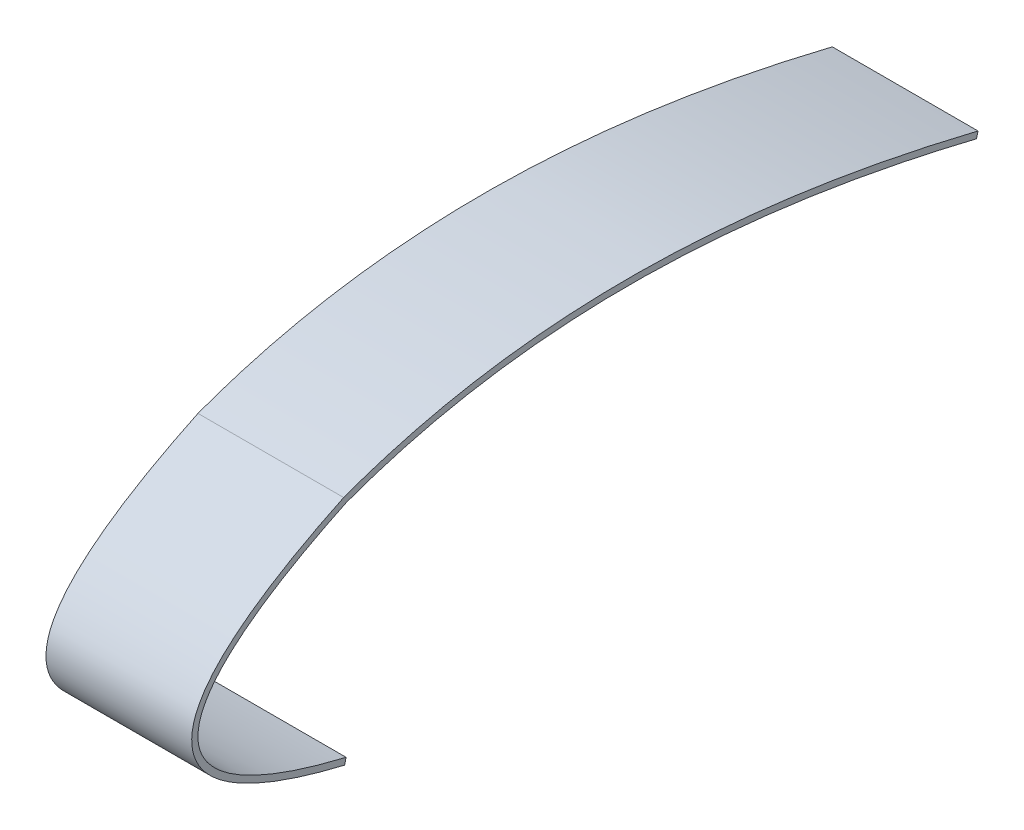
from build123d import *

# Parameters (mm, degrees)
BOSS_EXTRUDE1_DEPTH      = 350
BOSS_EXTRUDE1_DEPTH_BACK = 350


with BuildPart() as part:
    # Sketch2 → Boss-Extrude1 (new, two sides: drawn at the far end of the back side and taken through both)
    with BuildSketch(Plane(origin=(0, 0, 0), x_dir=(0, 0, -1), z_dir=(1, 0, 0)).offset(-BOSS_EXTRUDE1_DEPTH_BACK)):
        with BuildLine():
            Line((628.154342243, 1334.840970334), (635.276466748, 1363.983299386))
            add(Edge.make_bspline(
                [(635.276466748, 1363.983299386), (619.950844608, 1367.728744329), (589.310787735, 1375.144720028), (543.132871998, 1386.098493225), (496.811356933, 1396.857046899), (434.840693875, 1410.936503832), (357.011004214, 1428.015122272), (263.069150027, 1447.61141599), (168.625469332, 1466.243611988), (42.089030623, 1489.713351), (-117.119449153, 1516.311047234), (-309.483277706, 1543.317508561), (-567.257307298, 1572.073706113), (-891.024329092, 1593.097723414), (-1214.541523428, 1590.686861253), (-1471.807713301, 1572.562998322), (-1663.631190085, 1550.337124801), (-1853.974042759, 1518.942425185), (-2011.061096311, 1484.692669353), (-2135.631031426, 1452.17247831), (-2228.462601629, 1425.155446722), (-2305.289070598, 1400.396126606), (-2358.764539347, 1381.857676398), (-2385.42781594, 1372.281960642), (-2398.735147271, 1367.418607889), (-2406.341015013, 1364.615364779), (-2410.128187847, 1363.210469149), (-2412.023142039, 1362.506807039)],
                knots=[0, 0, 0, 0, 0.015631669, 0.031263337, 0.046895006, 0.062526674, 0.093790011, 0.125053348, 0.156316685, 0.187580023, 0.250106697, 0.312633371, 0.375160045, 0.500213393, 0.625266742, 0.687793416, 0.75032009, 0.812846764, 0.875373438, 0.906636776, 0.937900113, 0.96916345, 0.984795118, 0.992610953, 0.99651887, 0.998472828, 1.000426787, 1.000426787, 1.000426787, 1.000426787], degree=3))
            add(Edge.make_bspline(
                [(-2412.023142039, 1362.506807039), (-2413.547685005, 1361.783173298), (-2416.58052508, 1360.343120157), (-2422.770806958, 1357.394000429), (-2430.629476442, 1353.633622561), (-2440.279058854, 1348.987215064), (-2453.413610098, 1342.621685814), (-2470.319178756, 1334.346662012), (-2491.314943645, 1323.921419166), (-2512.951472876, 1313.013508143), (-2542.562818049, 1297.843068546), (-2580.835600509, 1277.736735779), (-2628.22946562, 1251.879622044), (-2676.544278137, 1224.390892005), (-2725.235979299, 1195.366380163), (-2789.937945212, 1154.742623046), (-2869.049993669, 1100.580279136), (-2956.862814821, 1030.817481431), (-3033.277910981, 956.760832624), (-3083.870485985, 891.587905629), (-3114.084609446, 837.188737736), (-3130.875847474, 795.192839564), (-3140.943680785, 752.025644532), (-3143.330027924, 707.941066275), (-3137.164624584, 663.534332821), (-3121.919596231, 619.601279239), (-3097.431626157, 576.773990458), (-3063.636002015, 535.312995393), (-3020.332850573, 495.202891062), (-2967.143972324, 456.332447081), (-2903.568412701, 418.602076564), (-2841.463794619, 388.065023687), (-2786.011348531, 364.174359874), (-2741.463495698, 346.528645614), (-2693.883096863, 329.159220608), (-2643.196256588, 312.071812213), (-2598.307184016, 298.073115592), (-2560.769262043, 287.022666073), (-2531.793385969, 278.810184481), (-2501.98589314, 270.674171138), (-2476.445974381, 263.958923859), (-2455.588765426, 258.626064752), (-2439.733465963, 254.646575467), (-2426.3381175, 251.346143993), (-2415.522221427, 248.717882491), (-2410.06311188, 247.4035123), (-2407.33892625, 246.750628497)],
                knots=[-0.001024345, -0.001024345, -0.001024345, -0.001024345, 0.002885906, 0.006796157, 0.01461666, 0.022437163, 0.030257665, 0.045898671, 0.061539676, 0.077180681, 0.092821687, 0.124103698, 0.155385708, 0.186667719, 0.21794973, 0.249231741, 0.311795762, 0.374359784, 0.436923806, 0.499487827, 0.530769838, 0.562051849, 0.59333386, 0.62461587, 0.655897881, 0.687179892, 0.718461903, 0.749743914, 0.781025924, 0.812307935, 0.843589946, 0.874871957, 0.890512962, 0.906153968, 0.921794973, 0.937435978, 0.953076984, 0.960897487, 0.968717989, 0.976538492, 0.984358995, 0.988269246, 0.992179497, 0.996089749, 0.998044874, 1, 1, 1, 1], degree=3))
            Line((-2407.33892625, 246.750628497), (-2400.347061488, 275.924483696))
            add(Edge.make_bspline(
                [(-2400.347061488, 1334.840970334), (-2786.942079152, 1151.341255779), (-3787.593971498, 608.394865861), (-2400.347061488, 275.924483696)],
                knots=[0, 0, 0, 0, 1, 1, 1, 1], degree=3))
            add(Edge.make_bspline(
                [(628.154342243, 1334.840970334), (-348.254688721, 1573.466602271), (-1437.488159342, 1692.383822459), (-2400.347061488, 1334.840970334)],
                knots=[0, 0, 0, 0, 1, 1, 1, 1], degree=3))
        make_face()
    extrude(amount=BOSS_EXTRUDE1_DEPTH + BOSS_EXTRUDE1_DEPTH_BACK)


solid = part.part
